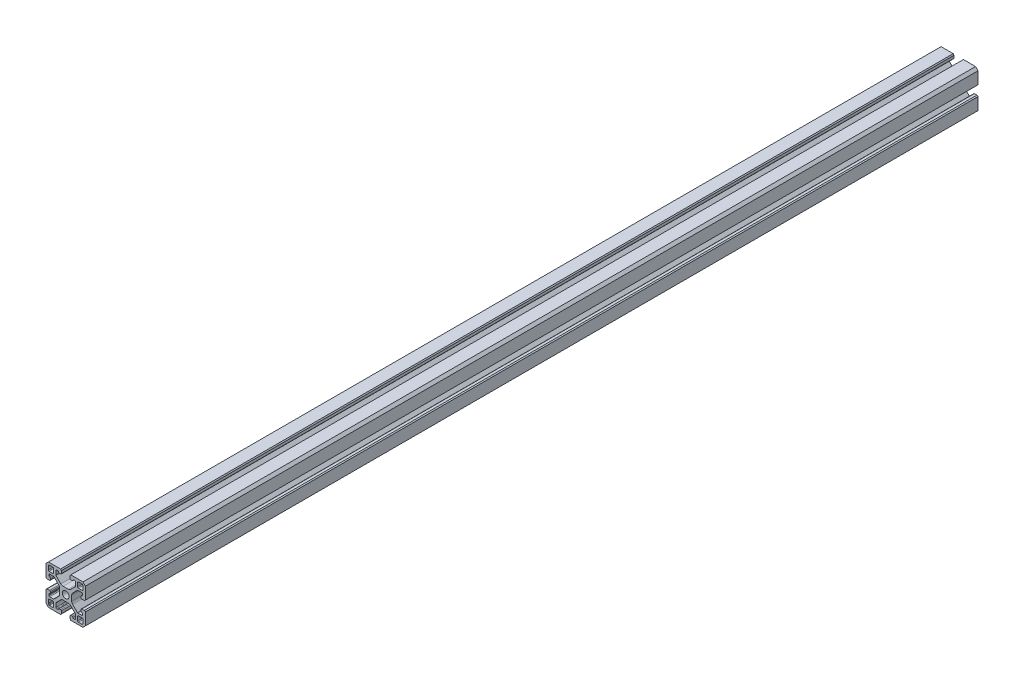
from build123d import *

# Parameters (mm, degrees)
SKETCH1_R           = 3.3147
BOSS_EXTRUDE1_DEPTH = 863.6


with BuildPart() as part:
    # Sketch1 → Boss-Extrude1 (new body)
    with BuildSketch(Plane(origin=(0, 0, 0), x_dir=(-1, 0, 0), z_dir=(0, 0, 1))):
        with BuildLine():
            Line((-19.05, 4.9276), (-19.05, 16.6878))
            Line((-19.05, 16.6878), (-16.6878, 19.05))
            Line((-16.6878, 19.05), (-4.9276, 19.05))
            Line((-4.9276, 19.05), (-4.1656, 18.044024186))
            Line((-4.1656, 18.044024186), (-4.1656, 15.669241304))
            ThreePointArc((-4.1656, 15.669241304), (-4.393507141, 15.125744462), (-4.940898734, 14.90735736))
            Line((-4.940898734, 14.90735736), (-6.223767748, 14.929749922))
            ThreePointArc((-6.223767748, 14.929749922), (-6.718113097, 15.123354458), (-6.966034507, 15.592816933))
            ThreePointArc((-6.966034507, 15.592816933), (-7.218934357, 16.066687743), (-7.7216, 16.256))
            Line((-7.7216, 16.256), (-8.763, 16.256))
            ThreePointArc((-8.763, 16.256), (-9.301815367, 16.032815367), (-9.525, 15.494))
            Line((-9.525, 15.494), (-9.525, 11.816287081))
            ThreePointArc((-9.525, 11.816287081), (-9.466996204, 11.524682306), (-9.301815367, 11.277471714))
            Line((-9.301815367, 11.277471714), (-4.7244731, 6.700129446))
            ThreePointArc((-4.7244731, 6.700129446), (-3.735630732, 6.0394061), (-2.569211631, 5.807390915))
            Line((-2.569211631, 5.807390915), (2.569211631, 5.807390915))
            ThreePointArc((2.569211631, 5.807390915), (3.735630732, 6.0394061), (4.7244731, 6.700129446))
            Line((4.7244731, 6.700129446), (9.301815367, 11.277471714))
            ThreePointArc((9.301815367, 11.277471714), (9.466996204, 11.524682306), (9.525, 11.816287081))
            Line((9.525, 11.816287081), (9.525, 15.494))
            ThreePointArc((9.525, 15.494), (9.301815367, 16.032815367), (8.763, 16.256))
            Line((8.763, 16.256), (7.7216, 16.256))
            ThreePointArc((7.7216, 16.256), (7.218934357, 16.066687743), (6.966034507, 15.592816933))
            ThreePointArc((6.966034507, 15.592816933), (6.718113097, 15.123354458), (6.223767748, 14.929749922))
            Line((6.223767748, 14.929749922), (4.940898734, 14.90735736))
            ThreePointArc((4.940898734, 14.90735736), (4.393507141, 15.125744462), (4.1656, 15.669241304))
            Line((4.1656, 15.669241304), (4.1656, 18.044024186))
            Line((4.1656, 18.044024186), (4.9276, 19.05))
            Line((4.9276, 19.05), (16.6878, 19.05))
            Line((16.6878, 19.05), (19.05, 16.6878))
            Line((19.05, 16.6878), (19.05, 4.9276))
            Line((19.05, 4.9276), (18.044024186, 4.1656))
            Line((18.044024186, 4.1656), (15.669241304, 4.1656))
            ThreePointArc((15.669241304, 4.1656), (15.125744462, 4.393507141), (14.90735736, 4.940898734))
            Line((14.90735736, 4.940898734), (14.929749922, 6.223767748))
            ThreePointArc((14.929749922, 6.223767748), (15.123354458, 6.718113097), (15.592816933, 6.966034507))
            ThreePointArc((15.592816933, 6.966034507), (16.066687743, 7.218934357), (16.256, 7.7216))
            Line((16.256, 7.7216), (16.256, 8.763))
            ThreePointArc((16.256, 8.763), (16.032815367, 9.301815367), (15.494, 9.525))
            Line((15.494, 9.525), (11.816287081, 9.525))
            ThreePointArc((11.816287081, 9.525), (11.524682306, 9.466996204), (11.277471714, 9.301815367))
            Line((11.277471714, 9.301815367), (6.700129446, 4.7244731))
            ThreePointArc((6.700129446, 4.7244731), (6.0394061, 3.735630732), (5.807390915, 2.569211631))
            Line((5.807390915, 2.569211631), (5.807390915, -2.569211631))
            ThreePointArc((5.807390915, -2.569211631), (6.0394061, -3.735630732), (6.700129446, -4.7244731))
            Line((6.700129446, -4.7244731), (11.277471714, -9.301815367))
            ThreePointArc((11.277471714, -9.301815367), (11.524682306, -9.466996204), (11.816287081, -9.525))
            Line((11.816287081, -9.525), (15.494, -9.525))
            ThreePointArc((15.494, -9.525), (16.032815367, -9.301815367), (16.256, -8.763))
            Line((16.256, -8.763), (16.256, -7.7216))
            ThreePointArc((16.256, -7.7216), (16.066687743, -7.218934357), (15.592816933, -6.966034507))
            ThreePointArc((15.592816933, -6.966034507), (15.123354458, -6.718113097), (14.929749922, -6.223767748))
            Line((14.929749922, -6.223767748), (14.90735736, -4.940898734))
            ThreePointArc((14.90735736, -4.940898734), (15.125744462, -4.393507141), (15.669241304, -4.1656))
            Line((15.669241304, -4.1656), (18.044024186, -4.1656))
            Line((18.044024186, -4.1656), (19.05, -4.9276))
            Line((19.05, -4.9276), (19.05, -16.6878))
            Line((19.05, -16.6878), (16.6878, -19.05))
            Line((16.6878, -19.05), (4.940898734, -19.05))
            Line((4.940898734, -19.05), (4.1656, -18.044024186))
            Line((4.1656, -18.044024186), (4.1656, -15.669241304))
            ThreePointArc((4.1656, -15.669241304), (4.393507141, -15.125744462), (4.940898734, -14.90735736))
            Line((4.940898734, -14.90735736), (6.223767748, -14.929749922))
            ThreePointArc((6.223767748, -14.929749922), (6.718113097, -15.123354458), (6.966034507, -15.592816933))
            ThreePointArc((6.966034507, -15.592816933), (7.218934357, -16.066687743), (7.7216, -16.256))
            Line((7.7216, -16.256), (8.763, -16.256))
            ThreePointArc((8.763, -16.256), (9.301815367, -16.032815367), (9.525, -15.494))
            Line((9.525, -15.494), (9.525, -11.816287081))
            ThreePointArc((9.525, -11.816287081), (9.466996204, -11.524682306), (9.301815367, -11.277471714))
            Line((9.301815367, -11.277471714), (4.7244731, -6.700129446))
            ThreePointArc((4.7244731, -6.700129446), (3.735630732, -6.0394061), (2.569211631, -5.807390915))
            Line((2.569211631, -5.807390915), (-2.569211631, -5.807390915))
            ThreePointArc((-2.569211631, -5.807390915), (-3.735630732, -6.0394061), (-4.7244731, -6.700129446))
            Line((-4.7244731, -6.700129446), (-9.301815367, -11.277471714))
            ThreePointArc((-9.301815367, -11.277471714), (-9.466996204, -11.524682306), (-9.525, -11.816287081))
            Line((-9.525, -11.816287081), (-9.525, -15.494))
            ThreePointArc((-9.525, -15.494), (-9.301815367, -16.032815367), (-8.763, -16.256))
            Line((-8.763, -16.256), (-7.7216, -16.256))
            ThreePointArc((-7.7216, -16.256), (-7.218934357, -16.066687743), (-6.966034507, -15.592816933))
            ThreePointArc((-6.966034507, -15.592816933), (-6.718113097, -15.123354458), (-6.223767748, -14.929749922))
            Line((-6.223767748, -14.929749922), (-4.940898734, -14.90735736))
            ThreePointArc((-4.940898734, -14.90735736), (-4.393507141, -15.125744462), (-4.1656, -15.669241304))
            Line((-4.1656, -15.669241304), (-4.1656, -18.044024186))
            Line((-4.1656, -18.044024186), (-4.9276, -19.05))
            Line((-4.9276, -19.05), (-16.6878, -19.05))
            Line((-16.6878, -19.05), (-19.05, -16.6878))
            Line((-19.05, -16.6878), (-19.05, -4.9276))
            Line((-19.05, -4.9276), (-18.044024186, -4.1656))
            Line((-18.044024186, -4.1656), (-15.669241304, -4.1656))
            ThreePointArc((-15.669241304, -4.1656), (-15.125744462, -4.393507141), (-14.90735736, -4.940898734))
            Line((-14.90735736, -4.940898734), (-14.929749922, -6.223767748))
            ThreePointArc((-14.929749922, -6.223767748), (-15.123354458, -6.718113097), (-15.592816933, -6.966034507))
            ThreePointArc((-15.592816933, -6.966034507), (-16.066687743, -7.218934357), (-16.256, -7.7216))
            Line((-16.256, -7.7216), (-16.256, -8.763))
            ThreePointArc((-16.256, -8.763), (-16.032815367, -9.301815367), (-15.494, -9.525))
            Line((-15.494, -9.525), (-11.816287081, -9.525))
            ThreePointArc((-11.816287081, -9.525), (-11.524682306, -9.466996204), (-11.277471714, -9.301815367))
            Line((-11.277471714, -9.301815367), (-6.700129446, -4.7244731))
            ThreePointArc((-6.700129446, -4.7244731), (-6.0394061, -3.735630732), (-5.807390915, -2.569211631))
            Line((-5.807390915, -2.569211631), (-5.807390915, 2.569211631))
            ThreePointArc((-5.807390915, 2.569211631), (-6.0394061, 3.735630732), (-6.700129446, 4.7244731))
            Line((-6.700129446, 4.7244731), (-11.277471714, 9.301815367))
            ThreePointArc((-11.277471714, 9.301815367), (-11.524682306, 9.466996204), (-11.816287081, 9.525))
            Line((-11.816287081, 9.525), (-15.494, 9.525))
            ThreePointArc((-15.494, 9.525), (-16.032815367, 9.301815367), (-16.256, 8.763))
            Line((-16.256, 8.763), (-16.256, 7.7216))
            ThreePointArc((-16.256, 7.7216), (-16.066687743, 7.218934357), (-15.592816933, 6.966034507))
            ThreePointArc((-15.592816933, 6.966034507), (-15.123354458, 6.718113097), (-14.929749922, 6.223767748))
            Line((-14.929749922, 6.223767748), (-14.90735736, 4.940898734))
            ThreePointArc((-14.90735736, 4.940898734), (-15.125744462, 4.393507141), (-15.669241304, 4.1656))
            Line((-15.669241304, 4.1656), (-18.044024186, 4.1656))
            Line((-18.044024186, 4.1656), (-19.05, 4.9276))
        make_face()
        with Locations(Location((0, 0, 0), (0, 0, 180))):
            Circle(SKETCH1_R, mode=Mode.SUBTRACT)
        with BuildLine():
            Line((-16.8656, 12.319), (-16.8656, 15.682887307))
            ThreePointArc((-16.8656, 15.682887307), (-16.807596204, 15.974492082), (-16.642415367, 16.221702674))
            Line((-16.642415367, 16.221702674), (-16.221702674, 16.642415367))
            ThreePointArc((-16.221702674, 16.642415367), (-15.974492082, 16.807596204), (-15.682887307, 16.8656))
            Line((-15.682887307, 16.8656), (-12.319, 16.8656))
            ThreePointArc((-12.319, 16.8656), (-11.780184633, 16.642415367), (-11.557, 16.1036))
            Line((-11.557, 16.1036), (-11.557, 12.319))
            ThreePointArc((-11.557, 12.319), (-11.780184633, 11.780184633), (-12.319, 11.557))
            Line((-12.319, 11.557), (-16.1036, 11.557))
            ThreePointArc((-16.1036, 11.557), (-16.642415367, 11.780184633), (-16.8656, 12.319))
        make_face(mode=Mode.SUBTRACT)
        with BuildLine():
            Line((-16.1036, -11.557), (-12.319, -11.557))
            ThreePointArc((-12.319, -11.557), (-11.780184633, -11.780184633), (-11.557, -12.319))
            Line((-11.557, -12.319), (-11.557, -16.1036))
            ThreePointArc((-11.557, -16.1036), (-11.780184633, -16.642415367), (-12.319, -16.8656))
            Line((-12.319, -16.8656), (-15.682887307, -16.8656))
            ThreePointArc((-15.682887307, -16.8656), (-15.974492082, -16.807596204), (-16.221702674, -16.642415367))
            Line((-16.221702674, -16.642415367), (-16.642415367, -16.221702674))
            ThreePointArc((-16.642415367, -16.221702674), (-16.807596204, -15.974492082), (-16.8656, -15.682887307))
            Line((-16.8656, -15.682887307), (-16.8656, -12.319))
            ThreePointArc((-16.8656, -12.319), (-16.642415367, -11.780184633), (-16.1036, -11.557))
        make_face(mode=Mode.SUBTRACT)
        with BuildLine():
            Line((15.682887307, -16.8656), (12.319, -16.8656))
            ThreePointArc((12.319, -16.8656), (11.780184633, -16.642415367), (11.557, -16.1036))
            Line((11.557, -16.1036), (11.557, -12.319))
            ThreePointArc((11.557, -12.319), (11.780184633, -11.780184633), (12.319, -11.557))
            Line((12.319, -11.557), (16.1036, -11.557))
            ThreePointArc((16.1036, -11.557), (16.642415367, -11.780184633), (16.8656, -12.319))
            Line((16.8656, -12.319), (16.8656, -15.682887307))
            ThreePointArc((16.8656, -15.682887307), (16.807596204, -15.974492082), (16.642415367, -16.221702674))
            Line((16.642415367, -16.221702674), (16.221702674, -16.642415367))
            ThreePointArc((16.221702674, -16.642415367), (15.974492082, -16.807596204), (15.682887307, -16.8656))
        make_face(mode=Mode.SUBTRACT)
        with BuildLine():
            Line((11.557, 12.319), (11.557, 16.1036))
            ThreePointArc((11.557, 16.1036), (11.780184633, 16.642415367), (12.319, 16.8656))
            Line((12.319, 16.8656), (15.682887307, 16.8656))
            ThreePointArc((15.682887307, 16.8656), (15.974492082, 16.807596204), (16.221702674, 16.642415367))
            Line((16.221702674, 16.642415367), (16.642415367, 16.221702674))
            ThreePointArc((16.642415367, 16.221702674), (16.807596204, 15.974492082), (16.8656, 15.682887307))
            Line((16.8656, 15.682887307), (16.8656, 12.319))
            ThreePointArc((16.8656, 12.319), (16.642415367, 11.780184633), (16.1036, 11.557))
            Line((16.1036, 11.557), (12.319, 11.557))
            ThreePointArc((12.319, 11.557), (11.780184633, 11.780184633), (11.557, 12.319))
        make_face(mode=Mode.SUBTRACT)
    extrude(amount=BOSS_EXTRUDE1_DEPTH)


solid = part.part
